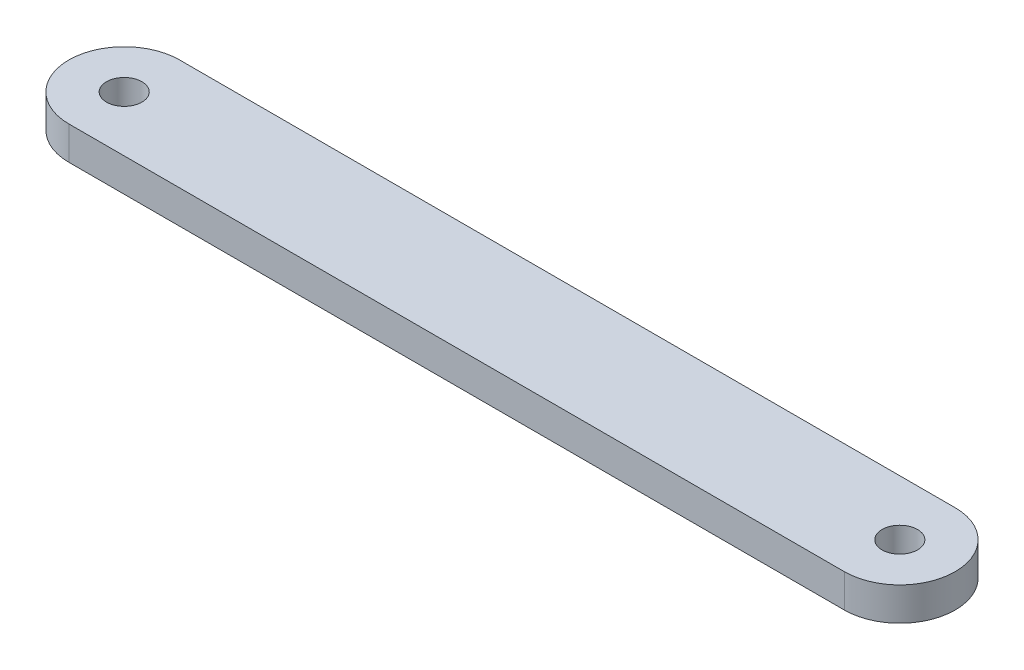
from build123d import *

# Parameters (mm, degrees)
SKETCH_1_R      = 1.6
EXTRUDE_1_DEPTH = 3


with BuildPart() as part:
    # ｽｹｯﾁ1 → ﾎﾞｽ - 押し出し1 (new body)
    with BuildSketch(Plane(origin=(0, 0, 0), x_dir=(1, 0, 0), z_dir=(0, 1, 0))):
        with BuildLine():
            Line((0, -5), (70, -5))
            ThreePointArc((70, -5), (75, 0), (70, 5))
            Line((70, 5), (0, 5))
            ThreePointArc((0, 5), (-5, 0), (0, -5))
        make_face()
        with Locations(Location((0, 0, 0), (0, 0, 270))):
            Circle(SKETCH_1_R, mode=Mode.SUBTRACT)
        with Locations(Location((70, 0, 0), (0, 0, 270))):
            Circle(SKETCH_1_R, mode=Mode.SUBTRACT)
    extrude(amount=EXTRUDE_1_DEPTH)


solid = part.part
